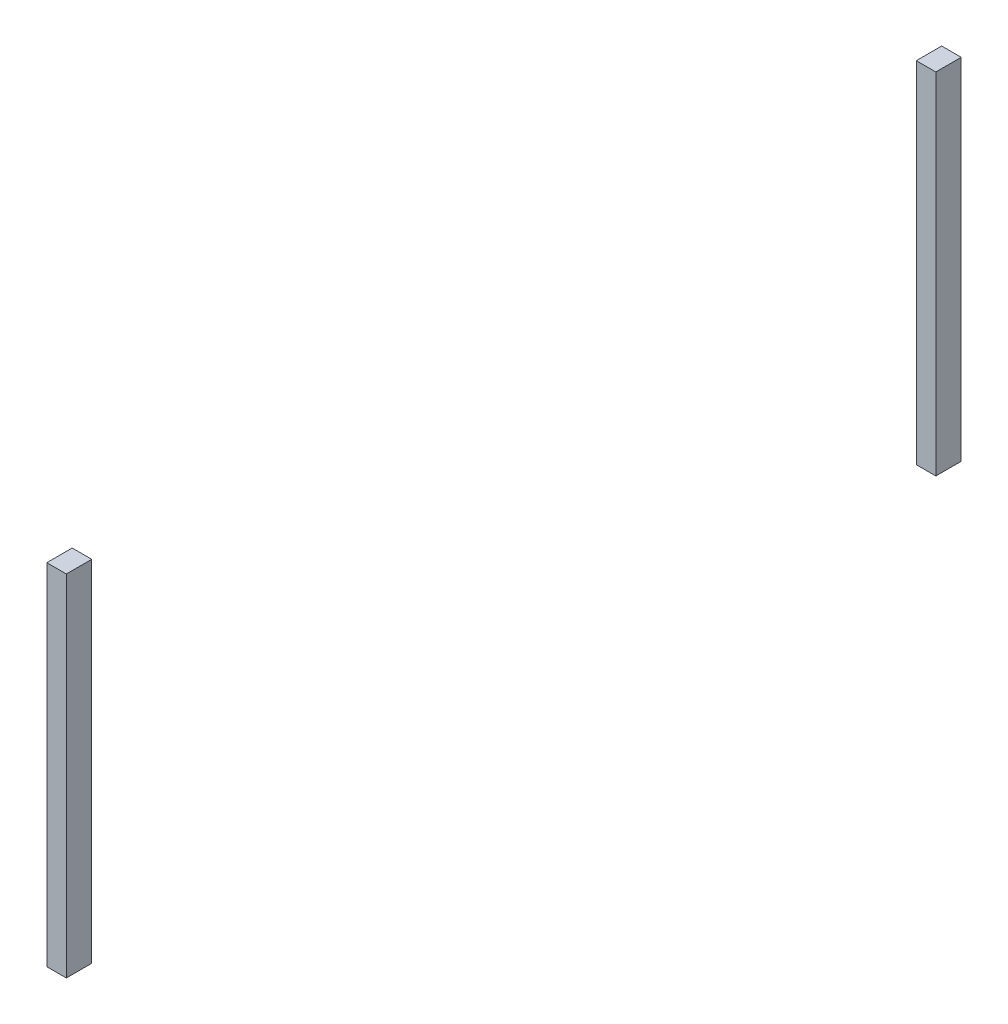
from build123d import *

# Parameters (mm, degrees)
SKETCH5_W           = 40
SKETCH5_H           = 551
BOSS_EXTRUDE2_DEPTH = 30.8
SKETCH10_W          = 40
SKETCH10_H          = 551
BOSS_EXTRUDE3_DEPTH = 30.8


with BuildPart() as part:
    # Sketch5 → Boss-Extrude2 (new body)
    with BuildSketch(Plane.ZY.offset(-256.75)):
        with Locations((1950.8, -124.5)):
            Rectangle(SKETCH5_W, SKETCH5_H)
    extrude(amount=-BOSS_EXTRUDE2_DEPTH)


with BuildPart() as body_2:
    # Sketch10 → Boss-Extrude3 (new body)
    with BuildSketch(Plane.ZY.offset(-256.75)):
        with Locations((581.6, -124.5)):
            Rectangle(SKETCH10_W, SKETCH10_H)
    extrude(amount=-BOSS_EXTRUDE3_DEPTH)


solid = Compound([part.part, body_2.part])
